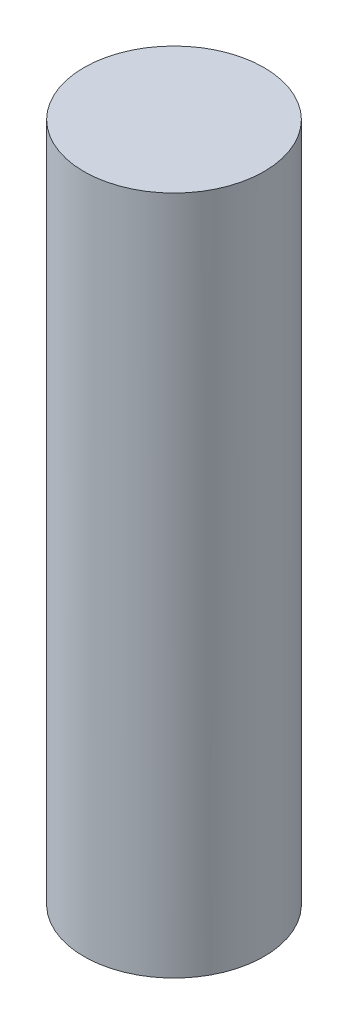
from build123d import *

# Parameters (mm, degrees)
SKETCH1_R           = 13.25
BOSS_EXTRUDE1_DEPTH = 100


with BuildPart() as part:
    # Sketch1 → Boss-Extrude1 (new body)
    with BuildSketch(Plane(origin=(0, 0, 0), x_dir=(1, 0, 0), z_dir=(0, 1, 0))):
        with Locations(Location((0, 0, 0), (0, 0, 270))):
            Circle(SKETCH1_R)
    extrude(amount=BOSS_EXTRUDE1_DEPTH)

    # Sketch2 → Revolve1 (revolve)
    with BuildSketch(Plane.XY, mode=Mode.PRIVATE) as revolve1_sk:
        with BuildLine():
            Line((0, -3), (0, 0.442183875))
            Line((0, 0.442183875), (13.25, 0))
            ThreePointArc((13.25, 0), (6.792689085, -2.24062679), (0, -3))
        make_face()
    revolve(revolve1_sk.sketch.rotate(Axis((0, -3, 0), (0, 1, 0)), 90), axis=Axis((0, -3, 0), (0, 1, 0)))


solid = part.part
